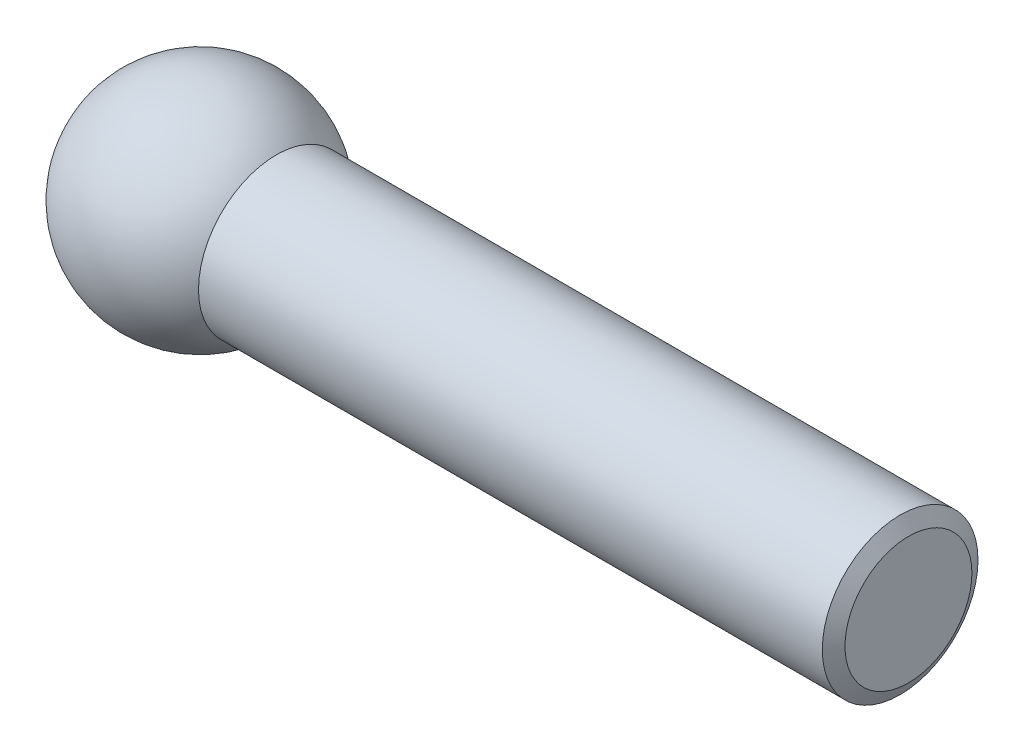
from build123d import *

# Parameters (mm, degrees)
SKETCH1_R           = 14.2875
BOSS_EXTRUDE1_DEPTH = 130
CHAMFER1_SIZE       = 1.524
CHAMFER1_SIZE2      = 2.639645431


with BuildPart() as part:
    # Sketch1 → Boss-Extrude1 (new body)
    with BuildSketch(Plane(origin=(0, 0, 0), x_dir=(0, 0, -1), z_dir=(1, 0, 0))):
        Circle(SKETCH1_R)
    extrude(amount=BOSS_EXTRUDE1_DEPTH)

    # Chamfer1
    chamfer1_edges = [part.edges().sort_by_distance(p)[0] for p in [
        (130, 0, 14.2875),
    ]]
    chamfer1_side = [part.faces().sort_by_distance(p)[0] for p in [
        (65, 0, 14.2875),
    ]]
    chamfer(chamfer1_edges, length=CHAMFER1_SIZE, length2=CHAMFER1_SIZE2, reference=chamfer1_side[0])

    # Sketch4 → Revolve1 (revolve)
    with BuildSketch(Plane.XY):
        with BuildLine():
            Line((-20, 0), (20, 0))
            ThreePointArc((20, 0), (0, 20), (-20, 0))
        make_face()
    revolve(axis=Axis((0, 0, 0), (1, 0, 0)))


solid = part.part
